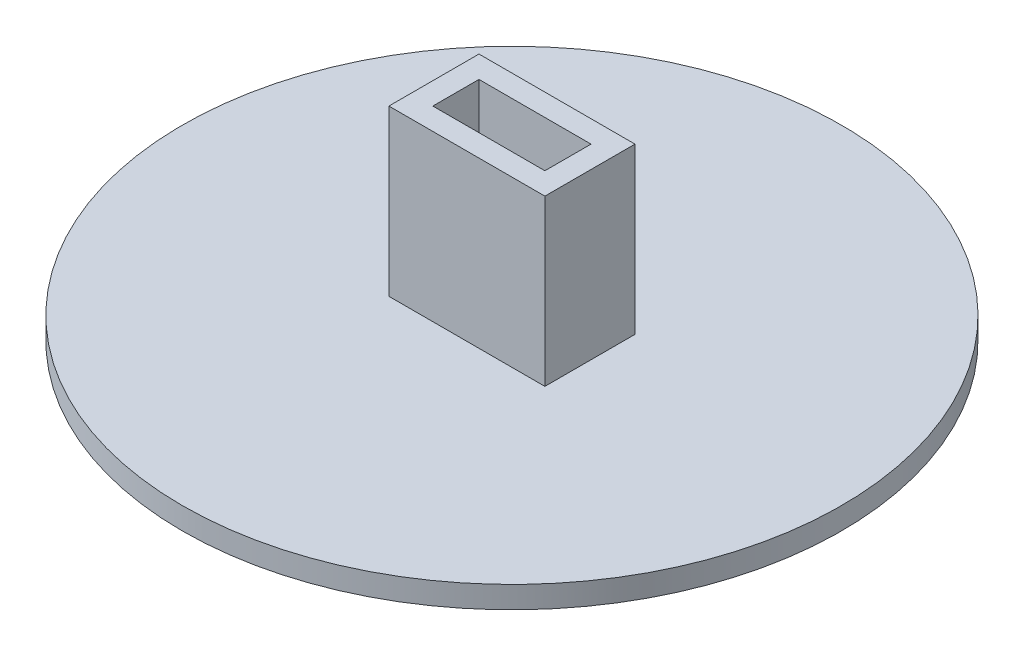
from build123d import *

# Parameters (mm, degrees)
ESQUISSE1_R        = 30
BOSS_EXTRU_1_DEPTH = 2
ESQUISSE2_W        = 14.2
ESQUISSE2_H        = 8.2
ESQUISSE2_W_2      = 10.2
ESQUISSE2_H_2      = 4.2
BOSS_EXTRU_2_DEPTH = 15


with BuildPart() as part:
    # Esquisse1 → Boss.-Extru.1 (new body)
    with BuildSketch(Plane(origin=(0, 0, 0), x_dir=(1, 0, 0), z_dir=(0, 1, 0))):
        with Locations(Location((0, 0, 0), (0, 0, 270))):
            Circle(ESQUISSE1_R)
    extrude(amount=BOSS_EXTRU_1_DEPTH)

    # Esquisse2 → Boss.-Extru.2 (add)
    with BuildSketch(Plane(origin=(0, 2, 0), x_dir=(1, 0, 0), z_dir=(0, 1, 0))):
        Rectangle(ESQUISSE2_W, ESQUISSE2_H)
        Rectangle(ESQUISSE2_W_2, ESQUISSE2_H_2, mode=Mode.SUBTRACT)
    extrude(amount=BOSS_EXTRU_2_DEPTH)


solid = part.part
